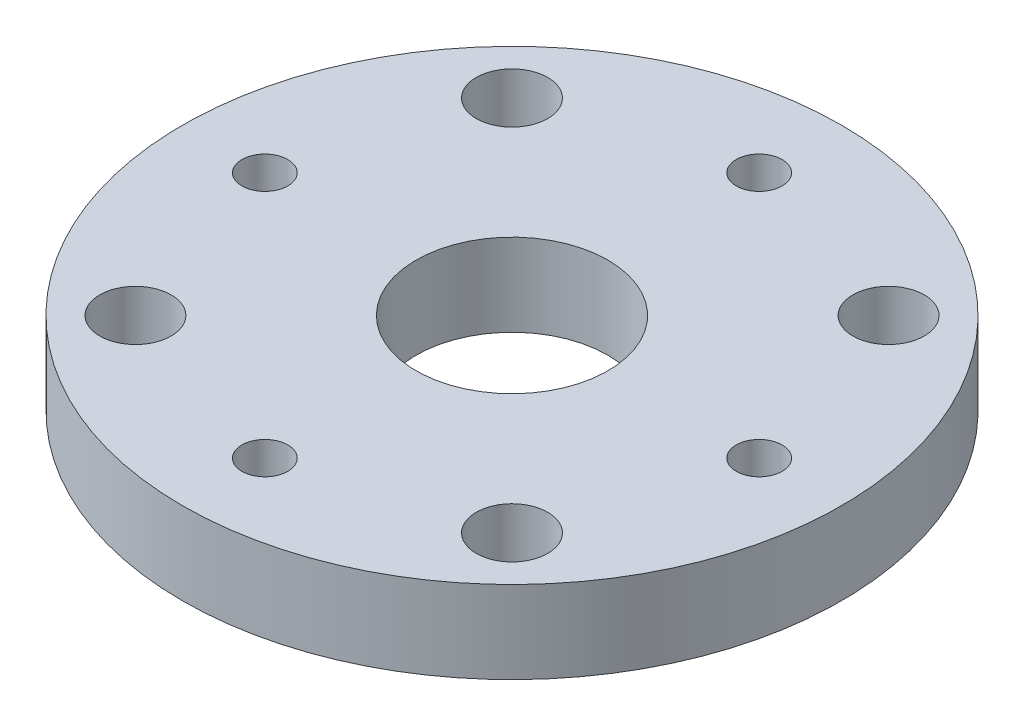
from build123d import *

# Parameters (mm, degrees)
SKETCH1_R           = 60
BOSS_EXTRUDE1_DEPTH = 15
SKETCH2_R           = 4.175
CUT_EXTRUDE1_DEPTH  = 10
SKETCH3_R           = 2.75
CUT_EXTRUDE2_DEPTH  = 87.168439698
SKETCH4_R           = 17.4625
CUT_EXTRUDE3_DEPTH  = 87.168439698
SKETCH5_R           = 6.5
CUT_EXTRUDE4_DEPTH  = 10


with BuildPart() as part:
    # Sketch1 → Boss-Extrude1 (new body)
    with BuildSketch(Plane(origin=(0, 0, 0), x_dir=(1, 0, 0), z_dir=(0, 1, 0))):
        with Locations(Location((0, 0, 0), (0, 0, 270))):
            Circle(SKETCH1_R)
    extrude(amount=BOSS_EXTRUDE1_DEPTH)

    # Sketch2 → Cut-Extrude1 (cut)
    with BuildSketch(Plane(origin=(0, 15, 0), x_dir=(1, 0, 0), z_dir=(0, 1, 0))):
        with Locations(Location((45, 0, 0), (0, 0, 270))):
            Circle(SKETCH2_R)
        with Locations(Location((0, -45, 0), (0, 0, 270))):
            Circle(SKETCH2_R)
        with Locations(Location((-45, 0, 0), (0, 0, 270))):
            Circle(SKETCH2_R)
        with Locations(Location((0, 45, 0), (0, 0, 270))):
            Circle(SKETCH2_R)
    extrude(amount=-CUT_EXTRUDE1_DEPTH, mode=Mode.SUBTRACT)

    # Sketch3 → Cut-Extrude2 (cut, through all)
    with BuildSketch(Plane.XZ):
        with Locations(Location((34.280536752, -34.280536752, 0), (0, 0, 270))):
            Circle(SKETCH3_R)
        with Locations(Location((-34.280536752, -34.280536752, 0), (0, 0, 270))):
            Circle(SKETCH3_R)
        with Locations(Location((-34.280536752, 34.280536752, 0), (0, 0, 270))):
            Circle(SKETCH3_R)
        with Locations(Location((34.280536752, 34.280536752, 0), (0, 0, 270))):
            Circle(SKETCH3_R)
    extrude(amount=-CUT_EXTRUDE2_DEPTH, mode=Mode.SUBTRACT)

    # Sketch4 → Cut-Extrude3 (cut, through all)
    with BuildSketch(Plane.XZ):
        with Locations(Location((0, 0, 0), (0, 0, 270))):
            Circle(SKETCH4_R)
    extrude(amount=-CUT_EXTRUDE3_DEPTH, mode=Mode.SUBTRACT)

    # Sketch5 → Cut-Extrude4 (cut)
    with BuildSketch(Plane(origin=(0, 15, 0), x_dir=(1, 0, 0), z_dir=(0, 1, 0))):
        with Locations(Location((-34.280536752, 34.280536752, 0), (0, 0, 270))):
            Circle(SKETCH5_R)
        with Locations(Location((34.280536752, 34.280536752, 0), (0, 0, 270))):
            Circle(SKETCH5_R)
        with Locations(Location((34.280536752, -34.280536752, 0), (0, 0, 270))):
            Circle(SKETCH5_R)
        with Locations(Location((-34.280536752, -34.280536752, 0), (0, 0, 270))):
            Circle(SKETCH5_R)
    extrude(amount=-CUT_EXTRUDE4_DEPTH, mode=Mode.SUBTRACT)


solid = part.part
